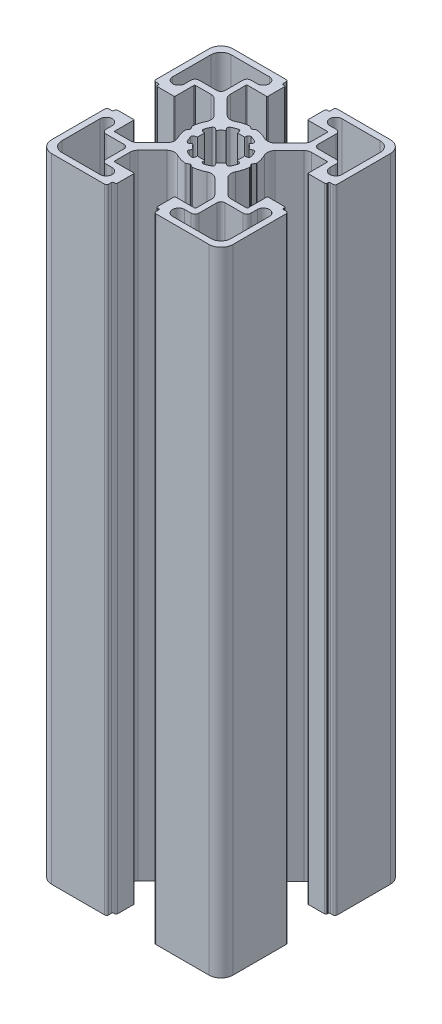
from build123d import *

# Parameters (mm, degrees)
BOSS_EXTRUDE1_DEPTH = 157


with BuildPart() as part:
    # Sketch1 → Boss-Extrude1 (new body)
    with BuildSketch(Plane(origin=(0, 0, 0), x_dir=(1, 0, 0), z_dir=(0, 1, 0))):
        with BuildLine():
            Line((7.563483841, 5.858695924), (11.129779796, 9.424987881))
            ThreePointArc((11.129779796, 9.424987881), (11.76062452, 9.846504465), (12.504756421, 9.994521395))
            Line((12.504756421, 9.994521395), (16.316902359, 9.994521395))
            ThreePointArc((16.316902359, 9.994521395), (16.458323963, 9.935942648), (16.51690271, 9.794521044))
            Line((16.51690271, 9.794521044), (16.51690271, 5.20001408))
            ThreePointArc((16.51690271, 5.20001408), (16.575481456, 5.058592476), (16.716903061, 5.000013729))
            Line((16.716903061, 5.000013729), (20.719599813, 5.000013729))
            ThreePointArc((20.719599813, 5.000013729), (20.931731335, 5.087881483), (21.019599089, 5.300013005))
            Line((21.019599089, 5.300013005), (21.019599089, 5.500003954))
            ThreePointArc((21.019599089, 5.500003954), (21.107466988, 5.71213583), (21.319598864, 5.800003729))
            Line((21.319598864, 5.800003729), (21.999979422, 5.800003729))
            ThreePointArc((21.999979422, 5.800003729), (22.353532548, 5.946450229), (22.499979048, 6.300003356))
            Line((22.499979048, 6.300003356), (22.499979048, 19.500015971))
            ThreePointArc((22.499979048, 19.500015971), (21.621300048, 21.62133473), (19.499981289, 22.50001373))
            Line((19.499981289, 22.50001373), (6.37570892, 22.50001373))
            ThreePointArc((6.37570892, 22.50001373), (6.022155794, 22.35356723), (5.875709294, 22.000014103))
            Line((5.875709294, 22.000014103), (5.875709294, 21.300013005))
            ThreePointArc((5.875709294, 21.300013005), (5.78784154, 21.087881482), (5.575710018, 21.000013729))
            Line((5.575710018, 21.000013729), (5.299998684, 21.000013729))
            ThreePointArc((5.299998684, 21.000013729), (5.087867516, 20.912146122), (4.999999909, 20.700014953))
            Line((4.999999909, 20.700014953), (4.999999909, 16.666812288))
            ThreePointArc((4.999999909, 16.666812288), (5.058578802, 16.52539033), (5.20000076, 16.466811437))
            Line((5.20000076, 16.466811437), (9.905385127, 16.466811437))
            ThreePointArc((9.905385127, 16.466811437), (10.046806731, 16.408232691), (10.105385478, 16.266811086))
            Line((10.105385478, 16.266811086), (10.105385478, 12.471582811))
            ThreePointArc((10.105385478, 12.471582811), (9.953144497, 11.706215717), (9.519598864, 11.057368824))
            Line((9.519598864, 11.057368824), (5.944897897, 7.482667857))
            ThreePointArc((5.944897897, 7.482667857), (4.854602604, 6.96783564), (3.666501718, 7.17329201))
            ThreePointArc((3.666501718, 7.17329201), (2.308631207, 7.714000899), (0.875344921, 8.000128222))
            ThreePointArc((0.875344921, 8.000128222), (0.813048151, 7.996979672), (0.754751151, 7.974792726))
            Line((0.754751151, 7.974792726), (0.112630526, 7.606936313))
            ThreePointArc((0.112630526, 7.606936313), (0.062965968, 7.559088119), (2.065e-06, 7.530953356))
            ThreePointArc((2.065e-06, 7.530953356), (-0.062961837, 7.559088119), (-0.112626394, 7.606936313))
            Line((-0.112626394, 7.606936313), (-0.754745572, 7.974791896))
            ThreePointArc((-0.754745572, 7.974791896), (-0.813042564, 7.99697884), (-0.875339325, 8.000127394))
            ThreePointArc((-0.875339325, 8.000127394), (-2.308625867, 7.714000103), (-3.666496612, 7.173291142))
            ThreePointArc((-3.666496612, 7.173291142), (-4.854599203, 6.967834938), (-5.944895348, 7.482669215))
            Line((-5.944895348, 7.482669215), (-9.519596331, 11.057370197))
            ThreePointArc((-9.519596331, 11.057370197), (-9.953141964, 11.70621709), (-10.105382945, 12.471584185))
            Line((-10.105382945, 12.471584185), (-10.105382945, 16.266811086))
            ThreePointArc((-10.105382945, 16.266811086), (-10.046804198, 16.408232691), (-9.905382594, 16.466811437))
            Line((-9.905382594, 16.466811437), (-5.200000942, 16.466811437))
            ThreePointArc((-5.200000942, 16.466811437), (-5.058578984, 16.52539033), (-5.000000091, 16.666812288))
            Line((-5.000000091, 16.666812288), (-5.000000091, 20.700014953))
            ThreePointArc((-5.000000091, 20.700014953), (-5.087867699, 20.912146122), (-5.299998867, 21.000013729))
            Line((-5.299998867, 21.000013729), (-5.575710202, 21.000013729))
            ThreePointArc((-5.575710202, 21.000013729), (-5.787841724, 21.087881482), (-5.875709478, 21.300013005))
            Line((-5.875709478, 21.300013005), (-5.875709478, 22.000014104))
            ThreePointArc((-5.875709478, 22.000014104), (-6.022155978, 22.35356723), (-6.375709104, 22.50001373))
            Line((-6.375709104, 22.50001373), (-19.499981473, 22.50001373))
            ThreePointArc((-19.499981473, 22.50001373), (-21.621300232, 21.62133473), (-22.499979232, 19.500015971))
            Line((-22.499979232, 19.500015971), (-22.499979232, 6.300003356))
            ThreePointArc((-22.499979232, 6.300003356), (-22.353532732, 5.946450229), (-21.999979605, 5.800003729))
            Line((-21.999979605, 5.800003729), (-21.319599047, 5.800003729))
            ThreePointArc((-21.319599047, 5.800003729), (-21.107467171, 5.71213583), (-21.019599271, 5.500003954))
            Line((-21.019599271, 5.500003954), (-21.019599271, 5.300013005))
            ThreePointArc((-21.019599271, 5.300013005), (-20.931731518, 5.087881483), (-20.719599995, 5.000013729))
            Line((-20.719599995, 5.000013729), (-16.716903244, 5.000013729))
            ThreePointArc((-16.716903244, 5.000013729), (-16.57548164, 5.058592476), (-16.516902894, 5.20001408))
            Line((-16.516902894, 5.20001408), (-16.516902894, 9.794521044))
            ThreePointArc((-16.516902894, 9.794521044), (-16.458324147, 9.935942648), (-16.316902543, 9.994521395))
            Line((-16.316902543, 9.994521395), (-12.504755574, 9.994521395))
            ThreePointArc((-12.504755574, 9.994521395), (-11.760623673, 9.846504465), (-11.129778949, 9.424987881))
            Line((-11.129778949, 9.424987881), (-7.563484024, 5.858696956))
            ThreePointArc((-7.563484024, 5.858696956), (-7.018857309, 4.793955357), (-7.200363541, 3.611860429))
            ThreePointArc((-7.200363541, 3.611860429), (-7.719534914, 2.299057702), (-7.999860794, 0.915436613))
            ThreePointArc((-7.999860794, 0.915436613), (-7.996805132, 0.851929863), (-7.97397167, 0.792591196))
            Line((-7.97397167, 0.792591196), (-7.540055962, 0.046829926))
            ThreePointArc((-7.540055962, 0.046829926), (-7.534291471, 0.023676009), (-7.531325428, 3.7e-07))
            ThreePointArc((-7.531325428, 3.7e-07), (-7.534291471, -0.023675268), (-7.540055962, -0.046829185))
            Line((-7.540055962, -0.046829185), (-7.97397167, -0.792590455))
            ThreePointArc((-7.97397167, -0.792590455), (-7.996805132, -0.851929122), (-7.999860794, -0.915435872))
            ThreePointArc((-7.999860794, -0.915435872), (-7.719534914, -2.299056961), (-7.200363541, -3.611859688))
            ThreePointArc((-7.200363541, -3.611859688), (-7.018857309, -4.793954616), (-7.563484024, -5.858696215))
            Line((-7.563484024, -5.858696215), (-11.12977998, -9.424988171))
            ThreePointArc((-11.12977998, -9.424988171), (-11.760624704, -9.846504756), (-12.504756605, -9.994521685))
            Line((-12.504756605, -9.994521685), (-16.316902543, -9.994521685))
            ThreePointArc((-16.316902543, -9.994521685), (-16.458324147, -9.935942938), (-16.516902894, -9.794521334))
            Line((-16.516902894, -9.794521334), (-16.516902894, -5.200014371))
            ThreePointArc((-16.516902894, -5.200014371), (-16.57548164, -5.058592767), (-16.716903244, -5.000014021))
            Line((-16.716903244, -5.000014021), (-20.719599995, -5.000014021))
            ThreePointArc((-20.719599995, -5.000014021), (-20.931731518, -5.087881774), (-21.019599271, -5.300013296))
            Line((-21.019599271, -5.300013296), (-21.019599271, -5.500004245))
            ThreePointArc((-21.019599271, -5.500004245), (-21.107467171, -5.71213612), (-21.319599047, -5.80000402))
            Line((-21.319599047, -5.80000402), (-21.999979605, -5.80000402))
            ThreePointArc((-21.999979605, -5.80000402), (-22.353532732, -5.94645052), (-22.499979232, -6.300003647))
            Line((-22.499979232, -6.300003647), (-22.499979232, -19.500016261))
            ThreePointArc((-22.499979232, -19.500016261), (-21.621300232, -21.62133502), (-19.499981473, -22.50001402))
            Line((-19.499981473, -22.50001402), (-6.375709104, -22.50001402))
            ThreePointArc((-6.375709104, -22.50001402), (-6.022155978, -22.35356752), (-5.875709478, -22.000014394))
            Line((-5.875709478, -22.000014394), (-5.875709478, -21.300013295))
            ThreePointArc((-5.875709478, -21.300013295), (-5.787841724, -21.087881773), (-5.575710202, -21.000014019))
            Line((-5.575710202, -21.000014019), (-5.299998867, -21.000014019))
            ThreePointArc((-5.299998867, -21.000014019), (-5.087867699, -20.912146412), (-5.000000091, -20.700015244))
            Line((-5.000000091, -20.700015244), (-5.000000091, -16.666812578))
            ThreePointArc((-5.000000091, -16.666812578), (-5.058578984, -16.52539062), (-5.200000942, -16.466811727))
            Line((-5.200000942, -16.466811727), (-9.905382594, -16.466811727))
            ThreePointArc((-9.905382594, -16.466811727), (-10.046804198, -16.40823298), (-10.105382945, -16.266811376))
            Line((-10.105382945, -16.266811376), (-10.105382945, -12.471581681))
            ThreePointArc((-10.105382945, -12.471581681), (-9.953141964, -11.706214586), (-9.519596331, -11.057367693))
            Line((-9.519596331, -11.057367693), (-5.944895364, -7.482666726))
            ThreePointArc((-5.944895364, -7.482666726), (-4.854601518, -6.967832762), (-3.66650075, -7.173286521))
            ThreePointArc((-3.66650075, -7.173286521), (-2.30862839, -7.713996836), (-0.875339942, -8.000124808))
            ThreePointArc((-0.875339942, -8.000124808), (-0.81304361, -7.99697628), (-0.754747019, -7.97478949))
            Line((-0.754747019, -7.97478949), (-0.112626395, -7.606933078))
            ThreePointArc((-0.112626395, -7.606933078), (-0.062961838, -7.559084884), (2.065e-06, -7.530950121))
            ThreePointArc((2.065e-06, -7.530950121), (0.062965968, -7.559084884), (0.112630526, -7.606933078))
            Line((0.112630526, -7.606933078), (0.754751151, -7.974789491))
            ThreePointArc((0.754751151, -7.974789491), (0.813048151, -7.996976437), (0.875344921, -8.000124987))
            ThreePointArc((0.875344921, -8.000124987), (2.308629801, -7.71399808), (3.666499103, -7.173290103))
            ThreePointArc((3.666499103, -7.173290103), (4.854601719, -6.967833865), (5.944897897, -7.482668146))
            Line((5.944897897, -7.482668146), (9.519598864, -11.057369113))
            ThreePointArc((9.519598864, -11.057369113), (9.953144497, -11.706216006), (10.105385478, -12.471583101))
            Line((10.105385478, -12.471583101), (10.105385478, -16.266811376))
            ThreePointArc((10.105385478, -16.266811376), (10.046806731, -16.40823298), (9.905385127, -16.466811727))
            Line((9.905385127, -16.466811727), (5.20000076, -16.466811727))
            ThreePointArc((5.20000076, -16.466811727), (5.058578802, -16.52539062), (4.999999909, -16.666812578))
            Line((4.999999909, -16.666812578), (4.999999909, -20.700015244))
            ThreePointArc((4.999999909, -20.700015244), (5.087867516, -20.912146412), (5.299998684, -21.000014019))
            Line((5.299998684, -21.000014019), (5.575710018, -21.000014019))
            ThreePointArc((5.575710018, -21.000014019), (5.78784154, -21.087881773), (5.875709294, -21.300013295))
            Line((5.875709294, -21.300013295), (5.875709294, -22.000014394))
            ThreePointArc((5.875709294, -22.000014394), (6.022155794, -22.35356752), (6.37570892, -22.50001402))
            Line((6.37570892, -22.50001402), (19.499981289, -22.50001402))
            ThreePointArc((19.499981289, -22.50001402), (21.621300048, -21.62133502), (22.499979048, -19.500016261))
            Line((22.499979048, -19.500016261), (22.499979048, -6.300003646))
            ThreePointArc((22.499979048, -6.300003646), (22.353532548, -5.94645052), (21.999979422, -5.80000402))
            Line((21.999979422, -5.80000402), (21.319598864, -5.80000402))
            ThreePointArc((21.319598864, -5.80000402), (21.107466988, -5.71213612), (21.019599089, -5.500004245))
            Line((21.019599089, -5.500004245), (21.019599089, -5.300013297))
            ThreePointArc((21.019599089, -5.300013297), (20.931731335, -5.087881774), (20.719599813, -5.000014021))
            Line((20.719599813, -5.000014021), (16.716903061, -5.000014021))
            ThreePointArc((16.716903061, -5.000014021), (16.575481456, -5.058592767), (16.51690271, -5.200014371))
            Line((16.51690271, -5.200014371), (16.51690271, -9.794521334))
            ThreePointArc((16.51690271, -9.794521334), (16.458323963, -9.935942938), (16.316902359, -9.994521685))
            Line((16.316902359, -9.994521685), (12.504756421, -9.994521685))
            ThreePointArc((12.504756421, -9.994521685), (11.76062452, -9.846504756), (11.129779797, -9.424988171))
            Line((11.129779797, -9.424988171), (7.56348384, -5.858696215))
            ThreePointArc((7.56348384, -5.858696215), (7.018857125, -4.793954616), (7.200363357, -3.611859689))
            ThreePointArc((7.200363357, -3.611859689), (7.71953473, -2.299056961), (7.99986061, -0.915435872))
            ThreePointArc((7.99986061, -0.915435872), (7.996804948, -0.851929122), (7.973971486, -0.792590456))
            Line((7.973971486, -0.792590456), (7.54005578, -0.046829188))
            ThreePointArc((7.54005578, -0.046829188), (7.53429135, -0.023675779), (7.531325245, -6.6e-07))
            ThreePointArc((7.531325245, -6.6e-07), (7.534291289, 0.023674979), (7.54005578, 0.046828898))
            Line((7.54005578, 0.046828898), (7.973971486, 0.792590166))
            ThreePointArc((7.973971486, 0.792590166), (7.996804949, 0.851928832), (7.99986061, 0.915435582))
            ThreePointArc((7.99986061, 0.915435582), (7.719534731, 2.299056671), (7.200363358, 3.611859399))
            ThreePointArc((7.200363358, 3.611859399), (7.018857126, 4.793954326), (7.563483841, 5.858695924))
        make_face()
        with BuildLine():
            Line((-17.99997923, 9.000204729), (-17.99997923, 10.550013476))
            ThreePointArc((-17.99997923, 10.550013476), (-17.70708623, 11.257119729), (-16.999979977, 11.550012729))
            Line((-16.999979977, 11.550012729), (-12.549977483, 11.550012729))
            ThreePointArc((-12.549977483, 11.550012729), (-11.84287123, 11.842905729), (-11.54997823, 12.550011982))
            Line((-11.54997823, 12.550011982), (-11.54997823, 17.000014476))
            ThreePointArc((-11.54997823, 17.000014476), (-11.25708523, 17.707120729), (-10.549978977, 18.000013729))
            Line((-10.549978977, 18.000013729), (-8.99997923, 18.000013729))
            ThreePointArc((-8.99997923, 18.000013729), (-7.49997923, 19.500013729), (-8.99997923, 21.000013729))
            Line((-8.99997923, 21.000013729), (-18.499981098, 21.000013729))
            ThreePointArc((-18.499981098, 21.000013729), (-20.26774673, 20.267781229), (-20.99997923, 18.500015597))
            Line((-20.99997923, 18.500015597), (-20.99997923, 9.000204729))
            ThreePointArc((-20.99997923, 9.000204729), (-19.49997923, 7.500204729), (-17.99997923, 9.000204729))
        make_face(mode=Mode.SUBTRACT)
        with BuildLine():
            Line((0.967518273, 5.481094418), (0.867385333, 4.924170439))
            ThreePointArc((0.867385333, 4.924170439), (-3.404e-06, 4.999981493), (-0.867392141, 4.924170439))
            Line((-0.867392141, 4.924170439), (-0.967525085, 5.48109443))
            ThreePointArc((-0.967525085, 5.48109443), (-1.18787304, 5.829596016), (-1.595121059, 5.894060173))
            ThreePointArc((-1.595121059, 5.894060173), (-2.337474987, 5.644060679), (-3.0416713, 5.300991221))
            ThreePointArc((-3.0416713, 5.300991221), (-3.284300912, 4.965857552), (-3.191387249, 4.562681715))
            Line((-3.191387249, 4.562681715), (-2.864003826, 4.098457013))
            ThreePointArc((-2.864003826, 4.098457013), (-3.530136355, 3.540908116), (-4.089716295, 2.876480837))
            Line((-4.089716295, 2.876480837), (-4.566781049, 3.208143991))
            ThreePointArc((-4.566781049, 3.208143991), (-4.968981864, 3.298752353), (-5.302521511, 3.056416481))
            ThreePointArc((-5.302521511, 3.056416481), (-5.650679971, 2.354692469), (-5.906040083, 1.614137194))
            ThreePointArc((-5.906040083, 1.614137194), (-5.840630787, 1.205603075), (-5.48985103, 0.986212864))
            Line((-5.48985103, 0.986212864), (-4.920549171, 0.887804317))
            ThreePointArc((-4.920549171, 0.887804317), (-5.000003405, -1.8509e-05), (-4.92054917, -0.887841334))
            Line((-4.92054917, -0.887841334), (-5.48973413, -0.986229672))
            ThreePointArc((-5.48973413, -0.986229672), (-5.84059179, -1.205595835), (-5.906027737, -1.614179668))
            ThreePointArc((-5.906027737, -1.614179668), (-5.650660878, -2.354735576), (-5.302495324, -3.056459191))
            ThreePointArc((-5.302495324, -3.056459191), (-4.968965627, -3.298777294), (-4.566781049, -3.208181006))
            Line((-4.566781049, -3.208181006), (-4.089716295, -2.876517852))
            ThreePointArc((-4.089716295, -2.876517852), (-3.530136355, -3.540945131), (-2.864003826, -4.098494028))
            Line((-2.864003826, -4.098494028), (-3.191315305, -4.562616715))
            ThreePointArc((-3.191315305, -4.562616715), (-3.284288314, -4.9658247), (-3.041645074, -5.301003633))
            ThreePointArc((-3.041645074, -5.301003633), (-2.337436005, -5.644074141), (-1.595068803, -5.894071587))
            ThreePointArc((-1.595068803, -5.894071587), (-1.187863583, -5.829591875), (-0.967525085, -5.481131446))
            Line((-0.967525085, -5.481131446), (-0.867392142, -4.924207454))
            ThreePointArc((-0.867392142, -4.924207454), (-3.405e-06, -5.000018508), (0.867385333, -4.924207454))
            Line((0.867385333, -4.924207454), (0.967518273, -5.481131433))
            ThreePointArc((0.967518273, -5.481131433), (1.187884068, -5.829612183), (1.595127065, -5.894056407))
            ThreePointArc((1.595127065, -5.894056407), (2.337463214, -5.64406402), (3.04164388, -5.301006091))
            ThreePointArc((3.04164388, -5.301006091), (3.284272431, -4.965888777), (3.191382531, -4.562721697))
            Line((3.191382531, -4.562721697), (2.863997017, -4.098494027))
            ThreePointArc((2.863997017, -4.098494027), (3.530129546, -3.540945131), (4.089709486, -2.876517851))
            Line((4.089709486, -2.876517851), (4.56677425, -3.208181013))
            ThreePointArc((4.56677425, -3.208181013), (4.968991235, -3.298778206), (5.302526078, -3.056413061))
            ThreePointArc((5.302526078, -3.056413061), (5.650679647, -2.354700627), (5.90603791, -1.614157983))
            ThreePointArc((5.90603791, -1.614157983), (5.840629826, -1.205623017), (5.489849863, -0.98623192))
            Line((5.489849863, -0.98623192), (4.920545674, -0.88782297))
            ThreePointArc((4.920545674, -0.88782297), (4.999996595, -1.94e-07), (4.92053917, 0.887822))
            Line((4.92053917, 0.887822), (5.489724104, 0.986210336))
            ThreePointArc((5.489724104, 0.986210336), (5.840595493, 1.20557008), (5.90603791, 1.614161218))
            ThreePointArc((5.90603791, 1.614161218), (5.650669489, 2.354728137), (5.302499707, 3.056461843))
            ThreePointArc((5.302499707, 3.056461843), (4.968955649, 3.298763634), (4.56677425, 3.208143998))
            Line((4.56677425, 3.208143998), (4.089709486, 2.876480836))
            ThreePointArc((4.089709486, 2.876480836), (3.530129546, 3.540908115), (2.863997017, 4.098457012))
            Line((2.863997017, 4.098457012), (3.191308496, 4.562579701))
            ThreePointArc((3.191308496, 4.562579701), (3.284310107, 4.965799272), (3.041663899, 5.300997928))
            ThreePointArc((3.041663899, 5.300997928), (2.337448292, 5.644073372), (1.595073641, 5.894073887))
            ThreePointArc((1.595073641, 5.894073887), (1.18784779, 5.829586125), (0.967518273, 5.481094418))
        make_face(mode=Mode.SUBTRACT)
        with BuildLine():
            Line((-20.99997923, -9.000205019), (-20.99997923, -18.500015887))
            ThreePointArc((-20.99997923, -18.500015887), (-20.26774673, -20.267781519), (-18.499981098, -21.000014019))
            Line((-18.499981098, -21.000014019), (-8.99997923, -21.000014019))
            ThreePointArc((-8.99997923, -21.000014019), (-7.49997923, -19.500014019), (-8.99997923, -18.000014019))
            Line((-8.99997923, -18.000014019), (-10.549978977, -18.000014019))
            ThreePointArc((-10.549978977, -18.000014019), (-11.25708523, -17.707121019), (-11.54997823, -17.000014766))
            Line((-11.54997823, -17.000014766), (-11.54997823, -12.550012272))
            ThreePointArc((-11.54997823, -12.550012272), (-11.84287123, -11.842906019), (-12.549977483, -11.550013019))
            Line((-12.549977483, -11.550013019), (-16.999979977, -11.550013019))
            ThreePointArc((-16.999979977, -11.550013019), (-17.70708623, -11.257120019), (-17.99997923, -10.550013766))
            Line((-17.99997923, -10.550013766), (-17.99997923, -9.000205019))
            ThreePointArc((-17.99997923, -9.000205019), (-19.49997923, -7.500205019), (-20.99997923, -9.000205019))
        make_face(mode=Mode.SUBTRACT)
        with BuildLine():
            Line((20.999979046, 9.000204729), (20.999979046, 18.500015597))
            ThreePointArc((20.999979046, 18.500015597), (20.267746546, 20.267781229), (18.499980914, 21.000013729))
            Line((18.499980914, 21.000013729), (8.999979046, 21.000013729))
            ThreePointArc((8.999979046, 21.000013729), (7.499979046, 19.500013729), (8.999979046, 18.000013729))
            Line((8.999979046, 18.000013729), (10.549978793, 18.000013729))
            ThreePointArc((10.549978793, 18.000013729), (11.257085046, 17.707120729), (11.549978046, 17.000014476))
            Line((11.549978046, 17.000014476), (11.549978046, 12.550011982))
            ThreePointArc((11.549978046, 12.550011982), (11.842871046, 11.842905729), (12.549977299, 11.550012729))
            Line((12.549977299, 11.550012729), (16.999979793, 11.550012729))
            ThreePointArc((16.999979793, 11.550012729), (17.707086046, 11.257119729), (17.999979046, 10.550013476))
            Line((17.999979046, 10.550013476), (17.999979046, 9.000204729))
            ThreePointArc((17.999979046, 9.000204729), (19.499979046, 7.500204729), (20.999979046, 9.000204729))
        make_face(mode=Mode.SUBTRACT)
        with BuildLine():
            Line((16.999979793, -11.550013019), (12.549977299, -11.550013019))
            ThreePointArc((12.549977299, -11.550013019), (11.842871046, -11.842906019), (11.549978046, -12.550012272))
            Line((11.549978046, -12.550012272), (11.549978046, -17.000014766))
            ThreePointArc((11.549978046, -17.000014766), (11.257085046, -17.707121019), (10.549978793, -18.000014019))
            Line((10.549978793, -18.000014019), (8.999979046, -18.000014019))
            ThreePointArc((8.999979046, -18.000014019), (7.499979046, -19.500014019), (8.999979046, -21.000014019))
            Line((8.999979046, -21.000014019), (18.499980914, -21.000014019))
            ThreePointArc((18.499980914, -21.000014019), (20.267746546, -20.267781519), (20.999979046, -18.500015887))
            Line((20.999979046, -18.500015887), (20.999979046, -9.000205019))
            ThreePointArc((20.999979046, -9.000205019), (19.499979046, -7.500205019), (17.999979046, -9.000205019))
            Line((17.999979046, -9.000205019), (17.999979046, -10.550013766))
            ThreePointArc((17.999979046, -10.550013766), (17.707086046, -11.257120019), (16.999979793, -11.550013019))
        make_face(mode=Mode.SUBTRACT)
    extrude(amount=BOSS_EXTRUDE1_DEPTH)


solid = part.part
